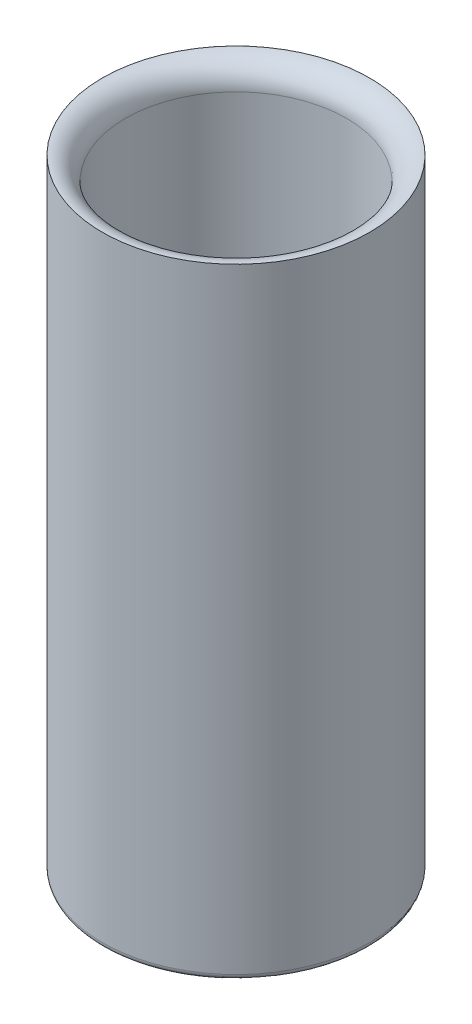
from build123d import *


with BuildPart() as part:
    # Szkic1 → Obrót1 (revolve)
    with BuildSketch(Plane.XY, mode=Mode.PRIVATE) as obr_t1_sk:
        with BuildLine():
            Line((-23.04, -50.853493976), (-23.04, 55.146506024))
            Line((-23.04, 55.146506024), (-23.02, 55.146506024))
            ThreePointArc((-23.02, 55.146506024), (-20.191572875, 53.974933149), (-19.02, 51.146506024))
            Line((-19.02, 51.146506024), (-19.02, -41.145145612))
            ThreePointArc((-19.02, -41.145145612), (-18.757277337, -41.820735819), (-18.107155743, -42.14134031))
            Line((-18.107155743, -42.14134031), (-9.51, -42.893493976))
            Line((-9.51, -42.893493976), (0, -42.893493976))
            Line((0, -42.893493976), (0, -51.853493976))
            Line((0, -51.853493976), (-22.04, -51.853493976))
            ThreePointArc((-22.04, -51.853493976), (-22.747106781, -51.560600757), (-23.04, -50.853493976))
        make_face()
    revolve(obr_t1_sk.sketch.rotate(Axis((0, -51.853493976, 0), (0, 1, 0)), 180), axis=Axis((0, -51.853493976, 0), (0, 1, 0)))


solid = part.part
